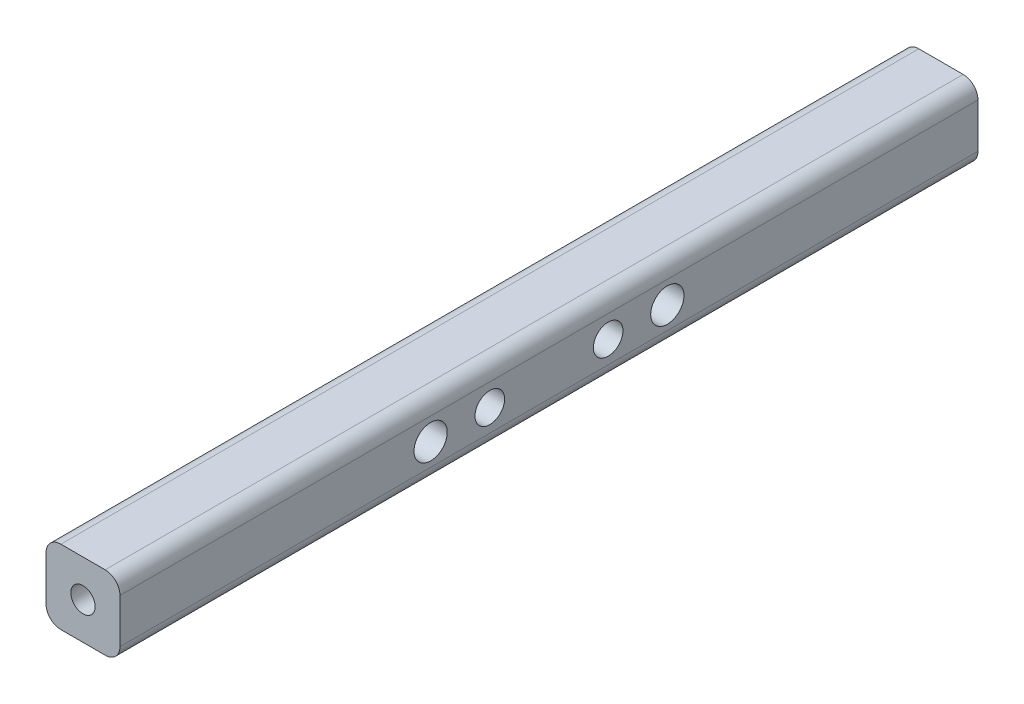
from build123d import *

# Parameters (mm, degrees)
ESQUISSE1_W                                        = 10
ESQUISSE1_H                                        = 10
BOSS_EXTRU_1_DEPTH                                 = 58
CONG_1_R                                           = 2
TROU_TARAUD_M41_D                                  = 3.3
TROU_TARAUD_M41_DEPTH                              = 11.5
TROU_TARAUD_M41_TIP                                = 0.991420021
TROU_TARAUD_M42_D                                  = 3.3
TROU_TARAUD_M42_DEPTH                              = 11.5
TROU_TARAUD_M42_TIP                                = 0.991420021
DIAM_TRE_DU_PER_AGE_4_0_4_1_D                      = 4
DIAM_TRE_DU_PER_AGE_4_0_4_1_DEPTH                  = 5
DIAM_TRE_DU_PER_AGE_4_0_4_1_TIP                    = 1.201721238
CHAMBRAGE_POUR_VIS_T_TE_HEXAGONALE_M41_D           = 4.5
CHAMBRAGE_POUR_VIS_T_TE_HEXAGONALE_M41_CBORE_D     = 8
CHAMBRAGE_POUR_VIS_T_TE_HEXAGONALE_M41_CBORE_DEPTH = 5


with BuildPart() as part:
    # Esquisse1 → Boss.-Extru.1 (new, symmetric)
    with BuildSketch(Plane.XY):
        Rectangle(ESQUISSE1_W, ESQUISSE1_H)
    extrude(amount=BOSS_EXTRU_1_DEPTH, both=True)

    # Congé1
    cong_1_edges = [part.edges().sort_by_distance(p)[0] for p in [
        (-5, 5, 0),
        (5, 5, 0),
        (5, -5, 0),
        (-5, -5, 0),
    ]]
    fillet(cong_1_edges, radius=CONG_1_R)

    # Trou taraudé M41
    with Locations(Plane.XY.offset(58)):
        with Locations((0, 0)):
            Hole(TROU_TARAUD_M41_D / 2, depth=TROU_TARAUD_M41_DEPTH)
            with Locations((0, 0, -(TROU_TARAUD_M41_DEPTH + TROU_TARAUD_M41_TIP / 2))):  # 118° drill point
                Cone(0, TROU_TARAUD_M41_D / 2, TROU_TARAUD_M41_TIP, mode=Mode.SUBTRACT)

    # Trou taraudé M42
    with Locations(Plane(origin=(0, 0, -58), x_dir=(-1, 0, 0), z_dir=(0, 0, -1))):
        with Locations((0, 0)):
            Hole(TROU_TARAUD_M42_D / 2, depth=TROU_TARAUD_M42_DEPTH)
            with Locations((0, 0, -(TROU_TARAUD_M42_DEPTH + TROU_TARAUD_M42_TIP / 2))):  # 118° drill point
                Cone(0, TROU_TARAUD_M42_D / 2, TROU_TARAUD_M42_TIP, mode=Mode.SUBTRACT)

    # Diamètre du perçage Ø4.0 (4)1
    with Locations(Plane(origin=(5, 0, 0), x_dir=(0, 0, -1), z_dir=(1, 0, 0))):
        with Locations((8, 0), (-8, 0)):
            Hole(DIAM_TRE_DU_PER_AGE_4_0_4_1_D / 2, depth=DIAM_TRE_DU_PER_AGE_4_0_4_1_DEPTH)
            with Locations((0, 0, -(DIAM_TRE_DU_PER_AGE_4_0_4_1_DEPTH + DIAM_TRE_DU_PER_AGE_4_0_4_1_TIP / 2))):  # 118° drill point
                Cone(0, DIAM_TRE_DU_PER_AGE_4_0_4_1_D / 2, DIAM_TRE_DU_PER_AGE_4_0_4_1_TIP, mode=Mode.SUBTRACT)

    # Chambrage pour vis à tête hexagonale M41 (through all)
    with Locations(Plane.ZY.offset(5)):
        with Locations((-16, 0), (16, 0)):
            CounterBoreHole(CHAMBRAGE_POUR_VIS_T_TE_HEXAGONALE_M41_D / 2, CHAMBRAGE_POUR_VIS_T_TE_HEXAGONALE_M41_CBORE_D / 2, CHAMBRAGE_POUR_VIS_T_TE_HEXAGONALE_M41_CBORE_DEPTH)


solid = part.part
